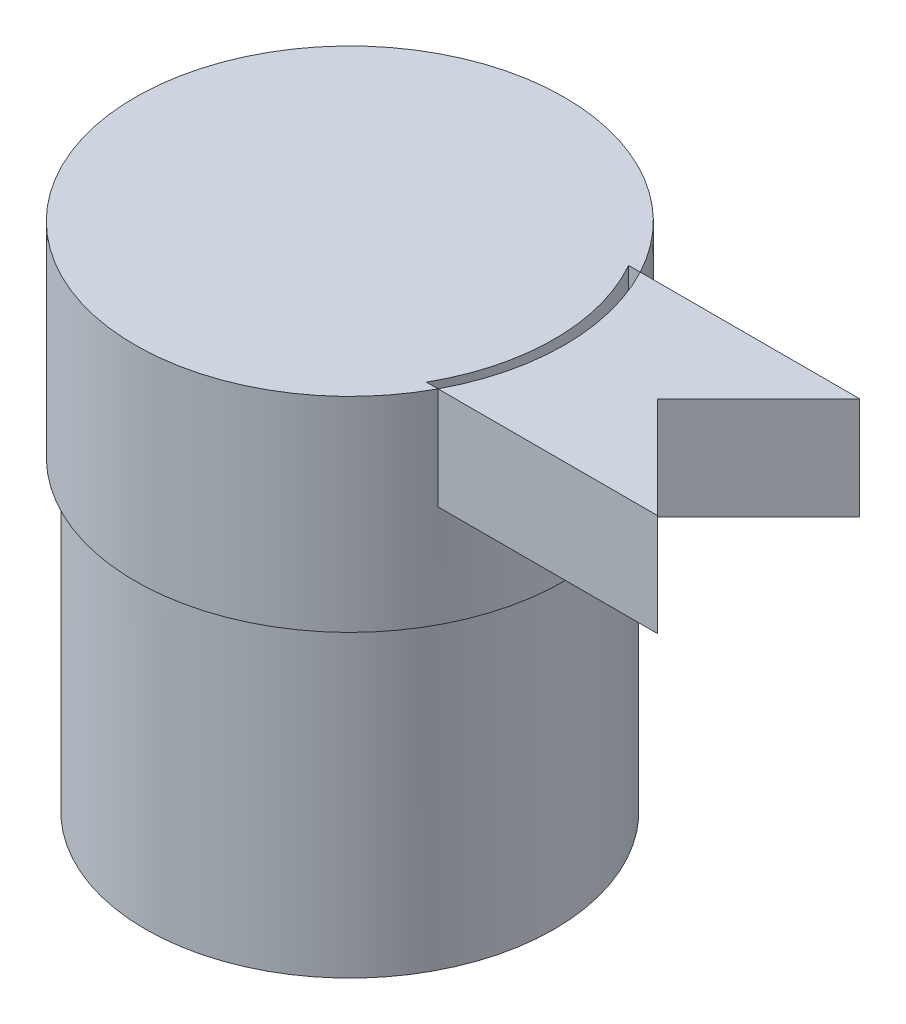
from build123d import *

# Parameters (mm, degrees)
SKETCH1_R           = 100
BOSS_EXTRUDE1_DEPTH = 200
SKETCH4_R           = 100
BOSS_EXTRUDE5_DEPTH = 50
SKETCH5_R           = 105
BOSS_EXTRUDE6_DEPTH = 50


with BuildPart() as part:
    # Sketch1 → Boss-Extrude1 (new body)
    with BuildSketch(Plane(origin=(0, 0, 0), x_dir=(1, 0, 0), z_dir=(0, 1, 0))):
        with Locations(Location((0, 0, 0), (0, 0, 270))):
            Circle(SKETCH1_R)
    extrude(amount=BOSS_EXTRUDE1_DEPTH)

    # Sketch4 → Boss-Extrude5 (add)
    with BuildSketch(Plane(origin=(0, 200, 0), x_dir=(1, 0, 0), z_dir=(0, 1, 0))):
        with BuildLine():
            Line((150.540661514, 0), (200, 49.459338486))
            Line((200, 49.459338486), (92.621670448, 49.459338486))
            ThreePointArc((92.621670448, 49.459338486), (101.85841987, 25.492396935), (105, 0))
            ThreePointArc((105, 0), (101.85841987, -25.492396935), (92.621670448, -49.459338486))
            Line((92.621670448, -49.459338486), (200, -49.459338486))
            Line((200, -49.459338486), (150.540661514, 0))
        make_face()
        with Locations(Location((0, 0, 0), (0, 0, 29.64294125))):
            Circle(SKETCH4_R)
        with BuildLine():
            Line((86.912449261, 49.459338486), (92.621670448, 49.459338486))
            ThreePointArc((92.621670448, 49.459338486), (-105, 0), (92.621670448, -49.459338486))
            Line((92.621670448, -49.459338486), (86.912449261, -49.459338486))
            ThreePointArc((86.912449261, -49.459338486), (-100, 0), (86.912449261, 49.459338486))
        make_face()
    extrude(amount=BOSS_EXTRUDE5_DEPTH)


with BuildPart() as boss_extrude5_piece_1:
    # of the separate pieces the step leaves, piece 1, a body of its own (boss_extrude5_pieces)
    add(part.part.solids().sort_by_distance((0, 0, 100))[0])

    # Sketch5 → Boss-Extrude6 (add)
    with BuildSketch(Plane.XZ.offset(-200)):
        with Locations(Location((0, 0, 0), (0, 0, 270))):
            Circle(SKETCH5_R)
    extrude(amount=BOSS_EXTRUDE6_DEPTH)


with BuildPart() as boss_extrude5_piece_2:
    # of the separate pieces the step leaves, piece 2, a body of its own (boss_extrude5_pieces)
    add(part.part.solids().sort_by_distance((200, 200, 49.459338486))[0])


solid = Compound([boss_extrude5_piece_1.part, boss_extrude5_piece_2.part])
